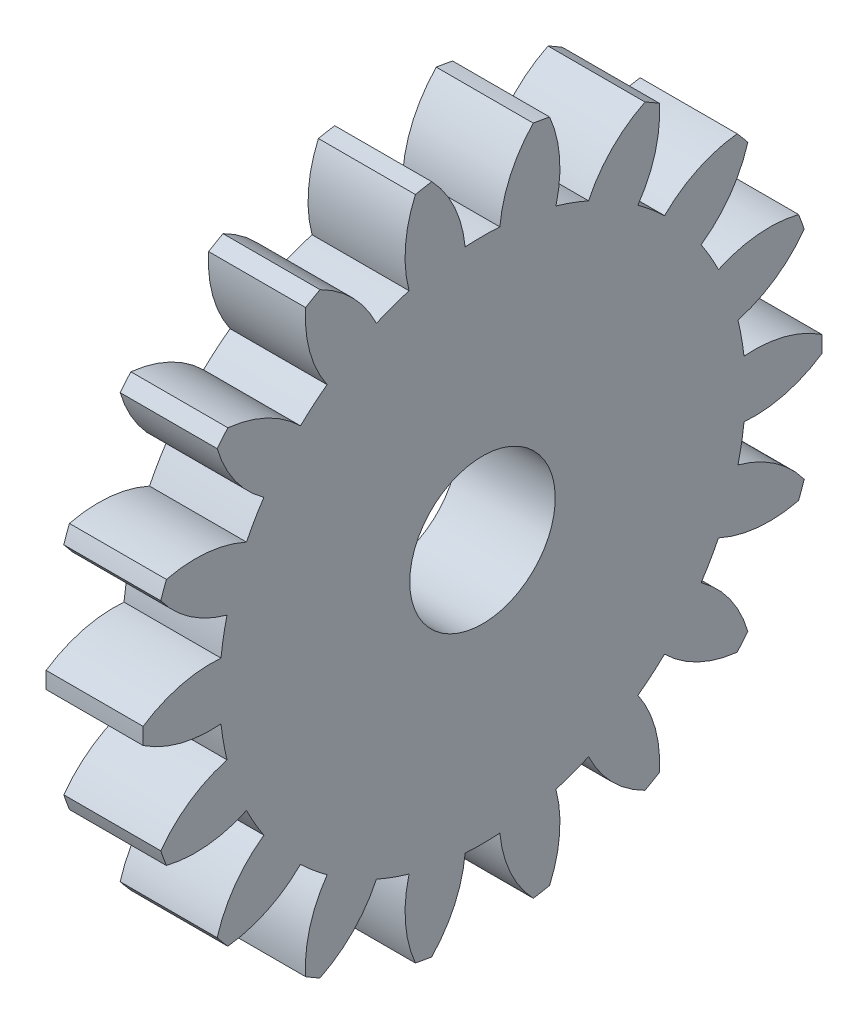
from build123d import *

# Parameters (mm, degrees)
BASPROSKE_W     = 2
BASPROSKE_H     = 7
TOOTHCUT_DEPTH  = 11.099504938
TEETHCUTS_COUNT = 18
TEETHCUTS_ANGLE = 340
BORSKE_R        = 1.5
BORE_DEPTH      = 50.0000508


with BuildPart() as part:
    # BasProSke → Base-Revolve (revolve)
    with BuildSketch(Plane(origin=(0, 0, 0), x_dir=(1, 0, 0), z_dir=(0, 1, 0)), mode=Mode.PRIVATE) as base_revolve_sk:
        with Locations((1, 3.5)):
            Rectangle(BASPROSKE_W, BASPROSKE_H)
    revolve(base_revolve_sk.sketch.rotate(Axis((-10, 0, 0), (1, 0, 0)), 180), axis=Axis((-10, 0, 0), (1, 0, 0)))

    # TooCutSke → ToothCut (cut, through all)
    with BuildSketch(Plane(origin=(0, 0, 0), x_dir=(0, 0, -1), z_dir=(1, 0, 0))):
        with BuildLine():
            ThreePointArc((0.358024643, 5.412170947), (0, 5.424), (-0.358024643, 5.412170947))
            ThreePointArc((-0.358024643, 5.412170947), (-0.580933876, 6.239177407), (-1.067969123, 6.94375166))
            ThreePointArc((-1.067969123, 6.94375166), (0, 7.0254), (1.067969123, 6.94375166))
            ThreePointArc((1.067969123, 6.94375166), (0.580933876, 6.239177407), (0.358024643, 5.412170947))
        make_face()
    toothcut = extrude(amount=TOOTHCUT_DEPTH, mode=Mode.SUBTRACT)

    # TeethCuts: ToothCut ×18 about axis
    teethcuts_axis = Axis((-10, 0, 0), (1, 0, 0))
    for i in range(1, TEETHCUTS_COUNT):
        add(toothcut.rotate(teethcuts_axis, i * TEETHCUTS_ANGLE / (TEETHCUTS_COUNT - 1)), mode=Mode.SUBTRACT)

    # BorSke → Bore (cut, symmetric)
    with BuildSketch(Plane(origin=(0, 0, 0), x_dir=(0, 0, -1), z_dir=(1, 0, 0))):
        with Locations(Location((0, 0, 0), (0, 0, 180))):
            Circle(BORSKE_R)
    extrude(amount=BORE_DEPTH, both=True, mode=Mode.SUBTRACT)


solid = part.part
